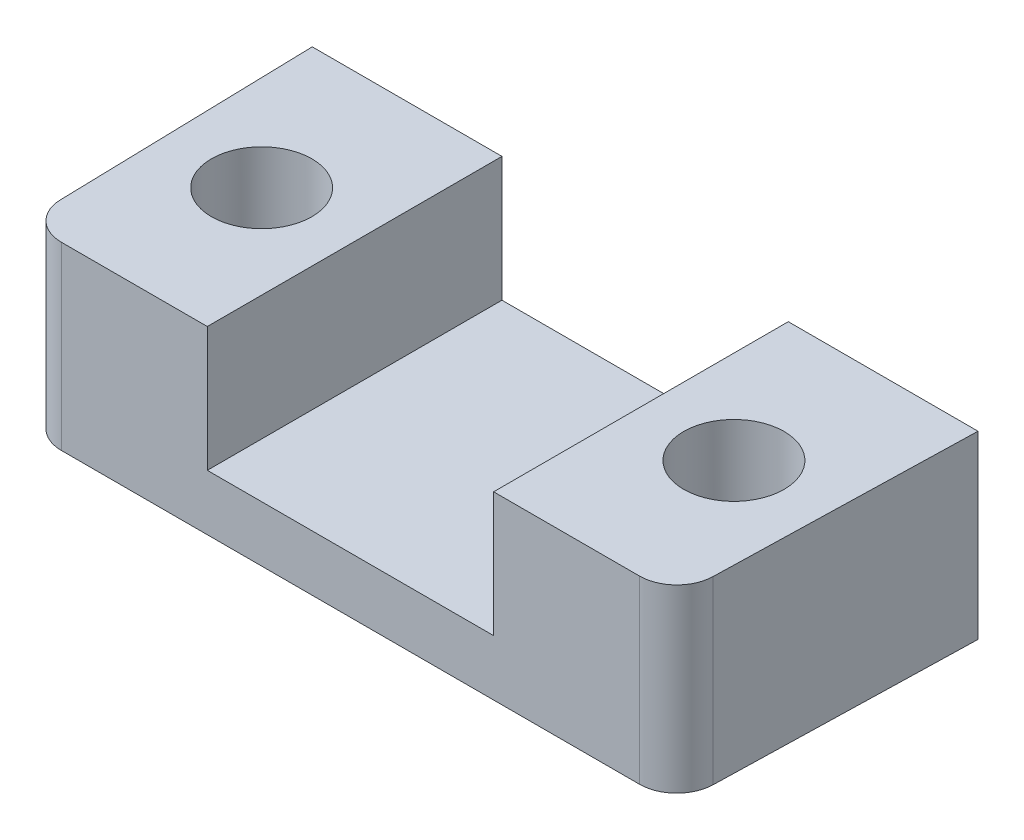
from build123d import *

# Parameters (mm, degrees)
BOSS_EXTRUDE2_DEPTH     = 9.7
CUT_EXTRUDE1_DEPTH      = 26.804010416
CUT_EXTRUDE1_DEPTH_BACK = 26.804010416
SKETCH4_W               = 15.4
SKETCH4_H               = 15.4
CUT_EXTRUDE2_DEPTH      = 26.804010416
CUT_EXTRUDE2_DEPTH_BACK = 26.804010416
SKETCH5_R               = 2.7


with BuildPart() as part:
    # Sketch3 → Boss-Extrude2 (new body)
    with BuildSketch(Plane(origin=(0, 0, 0), x_dir=(1, 0, 0), z_dir=(0, 1, 0))):
        with BuildLine():
            Line((-17.904307086, 15.849061213), (17.904307086, 15.849061213))
            Line((17.904307086, 15.849061213), (17.549718608, 1.948996904))
            ThreePointArc((17.549718608, 1.948996904), (16.946433835, 0.56786764), (15.550369043, 0))
            Line((15.550369043, 0), (-15.550369043, 0))
            ThreePointArc((-15.550369043, 0), (-16.946433835, 0.56786764), (-17.549718608, 1.948996904))
            Line((-17.549718608, 1.948996904), (-17.904307086, 15.849061213))
        make_face()
    extrude(amount=BOSS_EXTRUDE2_DEPTH)

    # Sketch4 → Cut-Extrude1 (cut, two sides: drawn at the far end of the back side and taken through both)
    with BuildSketch(Plane.XY.offset(-CUT_EXTRUDE1_DEPTH_BACK)):
        with Locations((0, 10.7)):
            Rectangle(SKETCH4_W, SKETCH4_H)
    extrude(amount=CUT_EXTRUDE1_DEPTH + CUT_EXTRUDE1_DEPTH_BACK, mode=Mode.SUBTRACT)

    # Sketch5 → Cut-Extrude2 (cut, two sides: drawn at the far end of the back side and taken through both)
    with BuildSketch(Plane(origin=(0, 9.7, 0), x_dir=(1, 0, 0), z_dir=(0, 1, 0)).offset(-CUT_EXTRUDE2_DEPTH_BACK)):
        with Locations(Location((-12.701076771, 7.924530607, 0), (0, 0, 270))):
            Circle(SKETCH5_R)
        with Locations(Location((12.701076771, 7.924530607, 0), (0, 0, 270))):
            Circle(SKETCH5_R)
    extrude(amount=CUT_EXTRUDE2_DEPTH + CUT_EXTRUDE2_DEPTH_BACK, mode=Mode.SUBTRACT)


solid = part.part
